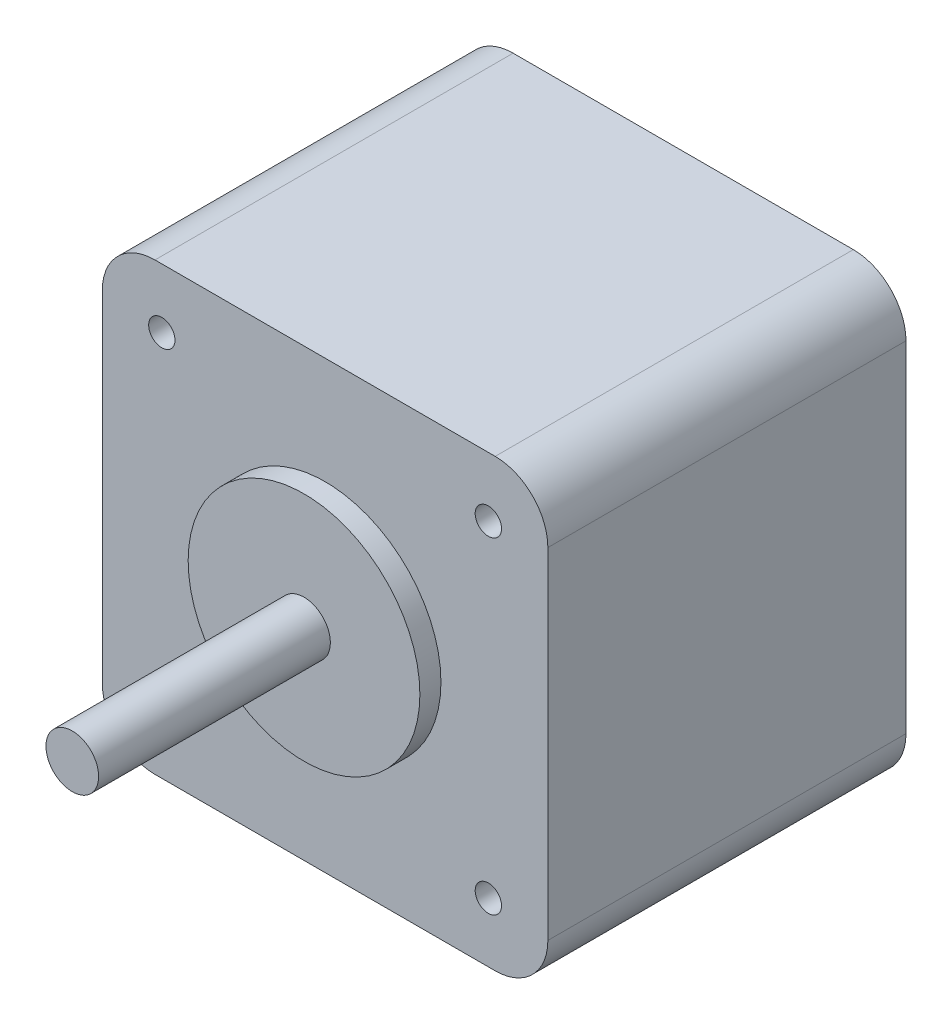
from build123d import *

# Parameters (mm, degrees)
AUFSATZ_LINEAR_AUSTRAGEN1_DEPTH = 34
SKIZZE2_R                       = 11
AUFSATZ_LINEAR_AUSTRAGEN2_DEPTH = 2
SKIZZE3_R                       = 2.5
AUFSATZ_LINEAR_AUSTRAGEN3_DEPTH = 22
M3_GEWINDEBOHRUNG1_D            = 2.5
M3_GEWINDEBOHRUNG1_DEPTH        = 8.5
M3_GEWINDEBOHRUNG1_TIP          = 0.751075774


with BuildPart() as part:
    # Skizze1 → Aufsatz-Linear austragen1 (new body)
    with BuildSketch(Plane.XY):
        with BuildLine():
            Line((5, 0), (37.3, 0))
            ThreePointArc((37.3, 0), (40.835533906, 1.464466094), (42.3, 5))
            Line((42.3, 5), (42.3, 37.3))
            ThreePointArc((42.3, 37.3), (40.835533906, 40.835533906), (37.3, 42.3))
            Line((37.3, 42.3), (5, 42.3))
            ThreePointArc((5, 42.3), (1.464466094, 40.835533906), (0, 37.3))
            Line((0, 37.3), (0, 5))
            ThreePointArc((0, 5), (1.464466094, 1.464466094), (5, 0))
        make_face()
    extrude(amount=AUFSATZ_LINEAR_AUSTRAGEN1_DEPTH)

    # Skizze2 → Aufsatz-Linear austragen2 (add)
    with BuildSketch(Plane.XY.offset(34)):
        with Locations(Location((21.15, 21.15, 0), (0, 0, 180))):
            Circle(SKIZZE2_R)
    extrude(amount=AUFSATZ_LINEAR_AUSTRAGEN2_DEPTH)

    # Skizze3 → Aufsatz-Linear austragen3 (add)
    with BuildSketch(Plane.XY.offset(36)):
        with Locations((21.15, 21.15)):
            Circle(SKIZZE3_R)
    extrude(amount=AUFSATZ_LINEAR_AUSTRAGEN3_DEPTH)

    # M3 Gewindebohrung1
    with Locations(Plane(origin=(5.65, 36.65, 34), x_dir=(1, 0, 0), z_dir=(0, 0, 1))):
        with Locations((0, 0), (31, 0), (31, -31), (0, -31)):
            Hole(M3_GEWINDEBOHRUNG1_D / 2, depth=M3_GEWINDEBOHRUNG1_DEPTH)
            with Locations((0, 0, -(M3_GEWINDEBOHRUNG1_DEPTH + M3_GEWINDEBOHRUNG1_TIP / 2))):  # 118° drill point
                Cone(0, M3_GEWINDEBOHRUNG1_D / 2, M3_GEWINDEBOHRUNG1_TIP, mode=Mode.SUBTRACT)


solid = part.part
